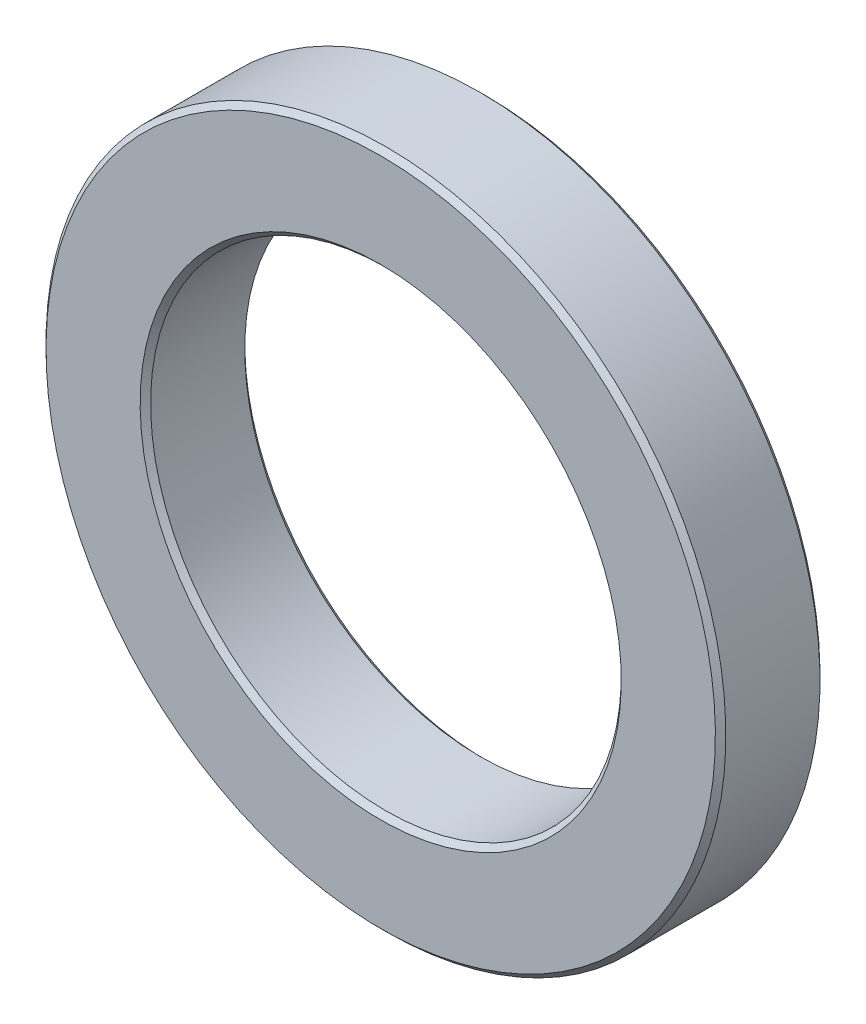
from build123d import *


with BuildPart() as part:
    # Sketch1 → Revolve1 (revolve)
    with BuildSketch(Plane(origin=(0, 0, 0), x_dir=(0, 0, -1), z_dir=(1, 0, 0))):
        Polygon((-9.637510275, 32.5), (-10.137510275, 32), (-10.137510275, 23), (-9.637510275, 22.5), (-0.637510275, 22.5), (-0.137510275, 23), (-0.137510275, 32), (-0.637510275, 32.5), align=None)
    revolve(axis=Axis((0, 0, 0), (0, 0, 1)))


solid = part.part
